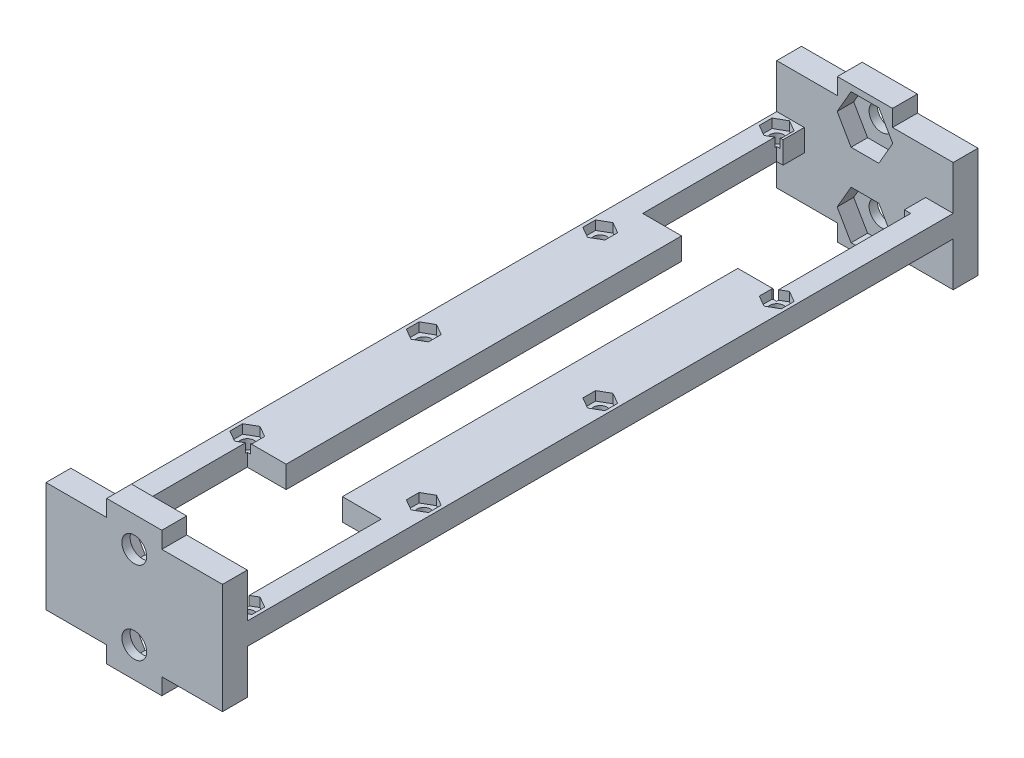
from build123d import *

# Parameters (mm, degrees)
SKETCH1_W               = 32
SKETCH1_H               = 128
BOSS_EXTRUDE1_DEPTH     = 4
SKETCH4_R               = 1.25
CUT_EXTRUDE2_DEPTH      = 10
SKETCH5_R               = 1.25
CUT_EXTRUDE3_DEPTH      = 10
CUT_EXTRUDE4_DEPTH      = 1.65
LPATTERN3_COUNT         = 4
LPATTERN3_PITCH         = 32
CUT_EXTRUDE5_DEPTH      = 1.65
LPATTERN4_COUNT         = 4
LPATTERN4_PITCH         = 32
SKETCH8_W               = 24.3
SKETCH8_H               = 24.3
CUT_EXTRUDE6_DEPTH      = 10
BOSS_EXTRUDE2_DEPTH     = 4.5
SKETCH11_W              = 10.2
SKETCH11_H              = 71.7
CUT_EXTRUDE7_DEPTH      = 72.92530848
CUT_EXTRUDE8_DEPTH      = 3
SKETCH12_R              = 2.25
CUT_EXTRUDE9_DEPTH      = 3
MIRROR3_COPY_1_DEPTH    = 3
MIRROR3_COPY_2_SKETCH_R = 2.25
MIRROR3_COPY_2_DEPTH    = 3
SKETCH14_W              = 22
SKETCH14_H              = 3.85
CUT_EXTRUDE13_DEPTH     = 10


with BuildPart() as part:
    # Sketch1 → Boss-Extrude1 (new body)
    with BuildSketch(Plane(origin=(0, 0, 0), x_dir=(1, 0, 0), z_dir=(0, 1, 0))):
        Rectangle(SKETCH1_W, SKETCH1_H)
    extrude(amount=BOSS_EXTRUDE1_DEPTH)

    # Sketch4 → Cut-Extrude2 (cut)
    with BuildSketch(Plane.XZ):
        with Locations(Location((13.4, 61.4, 0), (0, 0, 270))):
            Circle(SKETCH4_R)
    cut_extrude2 = extrude(amount=-CUT_EXTRUDE2_DEPTH, mode=Mode.SUBTRACT)

    # Sketch5 → Cut-Extrude3 (cut)
    with BuildSketch(Plane.XZ):
        with Locations(Location((-13.4, -61.4, 0), (0, 0, 270))):
            Circle(SKETCH5_R)
    cut_extrude3 = extrude(amount=-CUT_EXTRUDE3_DEPTH, mode=Mode.SUBTRACT)

    # Sketch6 → Cut-Extrude4 (cut)
    with BuildSketch(Plane(origin=(0, 4, 0), x_dir=(1, 0, 0), z_dir=(0, 1, 0))):
        Polygon((-15.400518683, 62.555), (-13.4, 63.71), (-11.399481317, 62.555), (-11.399481317, 60.245), (-13.4, 59.09), (-15.400518683, 60.245), align=None)
    cut_extrude4 = extrude(amount=-CUT_EXTRUDE4_DEPTH, mode=Mode.SUBTRACT)

    # LPattern3: Cut-Extrude3, Cut-Extrude4 ×4
    with Locations(*[(0, 0, i * LPATTERN3_PITCH) for i in range(1, LPATTERN3_COUNT)]):
        add(cut_extrude3, mode=Mode.SUBTRACT)
        add(cut_extrude4, mode=Mode.SUBTRACT)

    # Sketch7 → Cut-Extrude5 (cut)
    with BuildSketch(Plane(origin=(0, 4, 0), x_dir=(1, 0, 0), z_dir=(0, 1, 0))):
        Polygon((13.4, -59.09), (11.399481317, -60.245), (11.399481317, -62.555), (13.4, -63.71), (15.400518683, -62.555), (15.400518683, -60.245), align=None)
    cut_extrude5 = extrude(amount=-CUT_EXTRUDE5_DEPTH, mode=Mode.SUBTRACT)

    # LPattern4: Cut-Extrude2, Cut-Extrude5 ×4
    with Locations(*[(0, 0, -i * LPATTERN4_PITCH) for i in range(1, LPATTERN4_COUNT)]):
        add(cut_extrude2, mode=Mode.SUBTRACT)
        add(cut_extrude5, mode=Mode.SUBTRACT)

    # Sketch8 → Cut-Extrude6 (cut)
    with BuildSketch(Plane.XZ):
        with Locations((0, 48)):
            Rectangle(SKETCH8_W, SKETCH8_H)
    cut_extrude6 = extrude(amount=-CUT_EXTRUDE6_DEPTH, mode=Mode.SUBTRACT)

    # Mirror1: Cut-Extrude6 across plane
    add(cut_extrude6.mirror(Plane.XY), mode=Mode.SUBTRACT)

    # Sketch9 → Boss-Extrude2 (add)
    with BuildSketch(Plane(origin=(0, 0, -64), x_dir=(-1, 0, 0), z_dir=(0, 0, -1))):
        Polygon((-16, 12), (-5, 12), (-5, 15), (5, 15), (5, 12), (16, 12), (16, -8), (5, -8), (5, -11), (-5, -11), (-5, -8), (-16, -8), align=None)
    boss_extrude2 = extrude(amount=BOSS_EXTRUDE2_DEPTH)

    # Sketch11 → Cut-Extrude7 (cut, through all)
    with BuildSketch(Plane.XZ):
        Rectangle(SKETCH11_W, SKETCH11_H)
    extrude(amount=-CUT_EXTRUDE7_DEPTH, mode=Mode.SUBTRACT)

    # Sketch10 → Cut-Extrude8 (cut)
    with BuildSketch(Plane.XY.offset(-64)):
        Polygon((-2.52, 13.864768035), (2.52, 13.864768035), (5.04, 9.5), (2.52, 5.135231965), (-2.52, 5.135231965), (-5.04, 9.5), align=None)
    cut_extrude8 = extrude(amount=-CUT_EXTRUDE8_DEPTH, mode=Mode.SUBTRACT)

    # Sketch12 → Cut-Extrude9 (cut)
    with BuildSketch(Plane.XY.offset(-67)):
        with Locations((0, 9.5)):
            Circle(SKETCH12_R)
    cut_extrude9 = extrude(amount=-CUT_EXTRUDE9_DEPTH, mode=Mode.SUBTRACT)

    # Mirror2: Cut-Extrude8, Cut-Extrude9 across plane
    add(cut_extrude8.mirror(Plane.ZX.offset(2)), mode=Mode.SUBTRACT)
    add(cut_extrude9.mirror(Plane.ZX.offset(2)), mode=Mode.SUBTRACT)

    # Mirror3: Boss-Extrude2, Cut-Extrude8, Cut-Extrude9 across plane
    add(boss_extrude2.mirror(Plane.XY))
    add(cut_extrude8.mirror(Plane.XY), mode=Mode.SUBTRACT)
    add(cut_extrude9.mirror(Plane.XY), mode=Mode.SUBTRACT)

    # Mirror3 copy 1 sketch → Mirror3 copy 1 (cut)
    with BuildSketch(Plane(origin=(0, 4, 64), x_dir=(1, 0, 0), z_dir=(0, 0, -1))):
        Polygon((-2.52, 13.864768035), (2.52, 13.864768035), (5.04, 9.5), (2.52, 5.135231965), (-2.52, 5.135231965), (-5.04, 9.5), align=None)
    extrude(amount=-MIRROR3_COPY_1_DEPTH, mode=Mode.SUBTRACT)

    # Mirror3 copy 2 sketch → Mirror3 copy 2 (cut)
    with BuildSketch(Plane(origin=(0, 4, 67), x_dir=(1, 0, 0), z_dir=(0, 0, -1))):
        with Locations((0, 9.5)):
            Circle(MIRROR3_COPY_2_SKETCH_R)
    extrude(amount=-MIRROR3_COPY_2_DEPTH, mode=Mode.SUBTRACT)

    # Sketch14 → Cut-Extrude13 (cut)
    with BuildSketch(Plane.XZ):
        with Locations((0, 62.075)):
            Rectangle(SKETCH14_W, SKETCH14_H)
    cut_extrude13 = extrude(amount=-CUT_EXTRUDE13_DEPTH, mode=Mode.SUBTRACT)

    # Mirror4: Cut-Extrude13 across plane
    add(cut_extrude13.mirror(Plane.XY), mode=Mode.SUBTRACT)


solid = part.part
